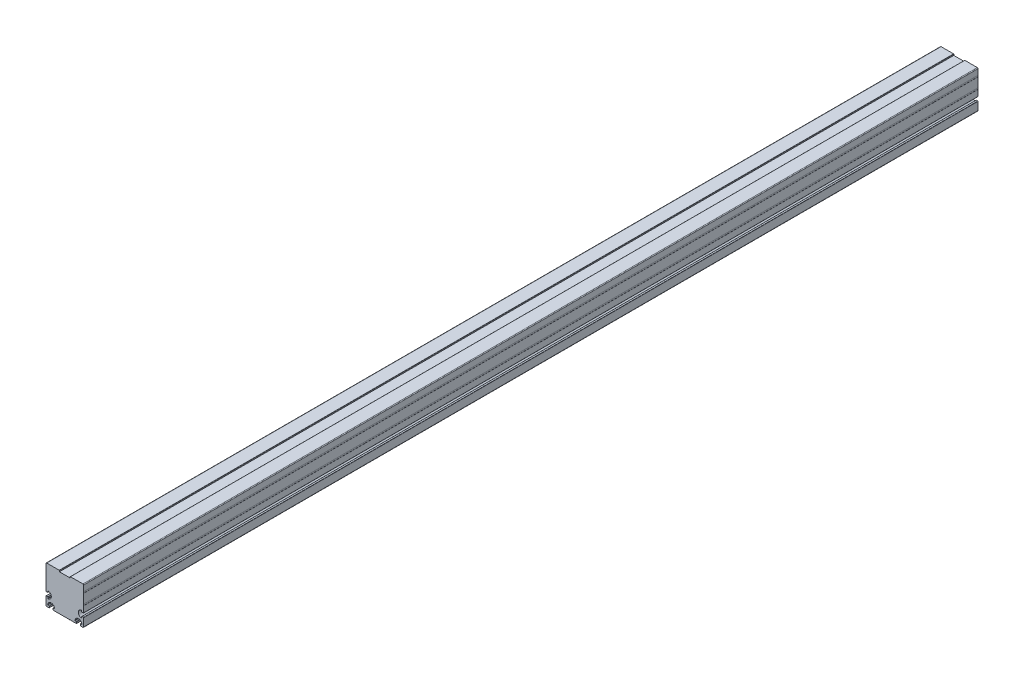
from build123d import *

# Parameters (mm, degrees)
BOSS_EXTRU_1_DEPTH = 1902


with BuildPart() as part:
    # Esquisse1 → Boss.-Extru.1 (new body)
    with BuildSketch(Plane.XY):
        with BuildLine():
            Line((-36.0005, -22.668579891), (-36.0005, -20.175011417))
            ThreePointArc((-36.0005, -20.175011417), (-36.146946609, -19.821458026), (-36.5005, -19.675011417))
            Line((-36.5005, -19.675011417), (-39.5005, -19.675011417))
            ThreePointArc((-39.5005, -19.675011417), (-39.854053391, -19.821458026), (-40.0005, -20.175011417))
            Line((-40.0005, -20.175011417), (-40.0005, -37.175011417))
            ThreePointArc((-40.0005, -37.175011417), (-39.561160172, -38.235671589), (-38.5005, -38.675011417))
            Line((-38.5005, -38.675011417), (-33.5005, -38.675011417))
            ThreePointArc((-33.5005, -38.675011417), (-33.146946609, -38.528564807), (-33.0005, -38.175011417))
            Line((-33.0005, -38.175011417), (-33.0005, -35.175011417))
            ThreePointArc((-33.0005, -35.175011417), (-33.146946609, -34.821458026), (-33.5005, -34.675011417))
            Line((-33.5005, -34.675011417), (-35.994068474, -34.675011417))
            ThreePointArc((-35.994068474, -34.675011417), (-36.210698507, -34.582547988), (-36.293792837, -34.362154274))
            ThreePointArc((-36.293792837, -34.362154274), (-29.0005, -27.375011417), (-21.707207163, -34.362154274))
            ThreePointArc((-21.707207163, -34.362154274), (-21.790301493, -34.582547988), (-22.006931526, -34.675011417))
            Line((-22.006931526, -34.675011417), (-24.5005, -34.675011417))
            ThreePointArc((-24.5005, -34.675011417), (-24.854053391, -34.821458026), (-25.0005, -35.175011417))
            Line((-25.0005, -35.175011417), (-25.0005, -38.175011417))
            ThreePointArc((-25.0005, -38.175011417), (-24.854053391, -38.528564807), (-24.5005, -38.675011417))
            Line((-24.5005, -38.675011417), (-13.5005, -38.675011417))
            Line((-13.5005, -38.675011417), (-13.5005, -38.425011417))
            Line((-13.5005, -38.425011417), (-10.5005, -38.425011417))
            Line((-10.5005, -38.425011417), (-10.5005, -38.675011417))
            Line((-10.5005, -38.675011417), (10.5005, -38.675011417))
            Line((10.5005, -38.675011417), (10.5005, -38.425011417))
            Line((10.5005, -38.425011417), (13.5005, -38.425011417))
            Line((13.5005, -38.425011417), (13.5005, -38.675011417))
            Line((13.5005, -38.675011417), (24.5005, -38.675011417))
            ThreePointArc((24.5005, -38.675011417), (24.854053391, -38.528564807), (25.0005, -38.175011417))
            Line((25.0005, -38.175011417), (25.0005, -35.175011417))
            ThreePointArc((25.0005, -35.175011417), (24.854053391, -34.821458026), (24.5005, -34.675011417))
            Line((24.5005, -34.675011417), (22.006931526, -34.675011417))
            ThreePointArc((22.006931526, -34.675011417), (21.790301493, -34.582547988), (21.707207163, -34.362154274))
            ThreePointArc((21.707207163, -34.362154274), (29.0005, -27.375011417), (36.293792837, -34.362154274))
            ThreePointArc((36.293792837, -34.362154274), (36.210698507, -34.582547988), (35.994068474, -34.675011417))
            Line((35.994068474, -34.675011417), (33.5005, -34.675011417))
            ThreePointArc((33.5005, -34.675011417), (33.146946609, -34.821458026), (33.0005, -35.175011417))
            Line((33.0005, -35.175011417), (33.0005, -38.175011417))
            ThreePointArc((33.0005, -38.175011417), (33.146946609, -38.528564807), (33.5005, -38.675011417))
            Line((33.5005, -38.675011417), (38.5005, -38.675011417))
            ThreePointArc((38.5005, -38.675011417), (39.561160172, -38.235671589), (40.0005, -37.175011417))
            Line((40.0005, -37.175011417), (40.0005, -20.175011417))
            ThreePointArc((40.0005, -20.175011417), (39.854053391, -19.821458026), (39.5005, -19.675011417))
            Line((39.5005, -19.675011417), (36.5005, -19.675011417))
            ThreePointArc((36.5005, -19.675011417), (36.146946609, -19.821458026), (36.0005, -20.175011417))
            Line((36.0005, -20.175011417), (36.0005, -22.668579891))
            ThreePointArc((36.0005, -22.668579891), (35.908036572, -22.885209924), (35.687642857, -22.968304254))
            ThreePointArc((35.687642857, -22.968304254), (28.7005, -15.675011417), (35.687642857, -8.38171858))
            ThreePointArc((35.687642857, -8.38171858), (35.908036572, -8.464812909), (36.0005, -8.681442943))
            Line((36.0005, -8.681442943), (36.0005, -11.175011417))
            ThreePointArc((36.0005, -11.175011417), (36.146946609, -11.528564807), (36.5005, -11.675011417))
            Line((36.5005, -11.675011417), (39.5005, -11.675011417))
            ThreePointArc((39.5005, -11.675011417), (39.854053391, -11.528564807), (40.0005, -11.175011417))
            Line((40.0005, -11.175011417), (40.0005, 1.824988583))
            Line((40.0005, 1.824988583), (39.7505, 1.824988583))
            Line((39.7505, 1.824988583), (39.7505, 4.824988583))
            Line((39.7505, 4.824988583), (40.0005, 4.824988583))
            Line((40.0005, 4.824988583), (40.0005, 24.824988583))
            Line((40.0005, 24.824988583), (39.7505, 24.824988583))
            Line((39.7505, 24.824988583), (39.7505, 27.824988583))
            Line((39.7505, 27.824988583), (40.0005, 27.824988583))
            Line((40.0005, 27.824988583), (40.0005, 39.824988583))
            ThreePointArc((40.0005, 39.824988583), (39.561160172, 40.885648755), (38.5005, 41.324988583))
            Line((38.5005, 41.324988583), (12.0005, 41.324988583))
            ThreePointArc((12.0005, 41.324988583), (11.646946609, 41.178541974), (11.5005, 40.824988583))
            Line((11.5005, 40.824988583), (11.5005, 38.675011417))
            Line((11.5005, 38.675011417), (-11.5005, 38.675011417))
            Line((-11.5005, 38.675011417), (-11.5005, 40.824988583))
            ThreePointArc((-11.5005, 40.824988583), (-11.646946609, 41.178541974), (-12.0005, 41.324988583))
            Line((-12.0005, 41.324988583), (-38.5005, 41.324988583))
            ThreePointArc((-38.5005, 41.324988583), (-39.561160172, 40.885648755), (-40.0005, 39.824988583))
            Line((-40.0005, 39.824988583), (-40.0005, 27.824988583))
            Line((-40.0005, 27.824988583), (-39.7505, 27.824988583))
            Line((-39.7505, 27.824988583), (-39.7505, 24.824988583))
            Line((-39.7505, 24.824988583), (-40.0005, 24.824988583))
            Line((-40.0005, 24.824988583), (-40.0005, 4.824988583))
            Line((-40.0005, 4.824988583), (-39.7505, 4.824988583))
            Line((-39.7505, 4.824988583), (-39.7505, 1.824988583))
            Line((-39.7505, 1.824988583), (-40.0005, 1.824988583))
            Line((-40.0005, 1.824988583), (-40.0005, -11.175011417))
            ThreePointArc((-40.0005, -11.175011417), (-39.854053391, -11.528564807), (-39.5005, -11.675011417))
            Line((-39.5005, -11.675011417), (-36.5005, -11.675011417))
            ThreePointArc((-36.5005, -11.675011417), (-36.146946609, -11.528564807), (-36.0005, -11.175011417))
            Line((-36.0005, -11.175011417), (-36.0005, -8.681442943))
            ThreePointArc((-36.0005, -8.681442943), (-35.908036572, -8.464812909), (-35.687642857, -8.38171858))
            ThreePointArc((-35.687642857, -8.38171858), (-28.7005, -15.675011417), (-35.687642857, -22.968304254))
            ThreePointArc((-35.687642857, -22.968304254), (-35.908036572, -22.885209924), (-36.0005, -22.668579891))
        make_face()
    extrude(amount=BOSS_EXTRU_1_DEPTH)


solid = part.part
